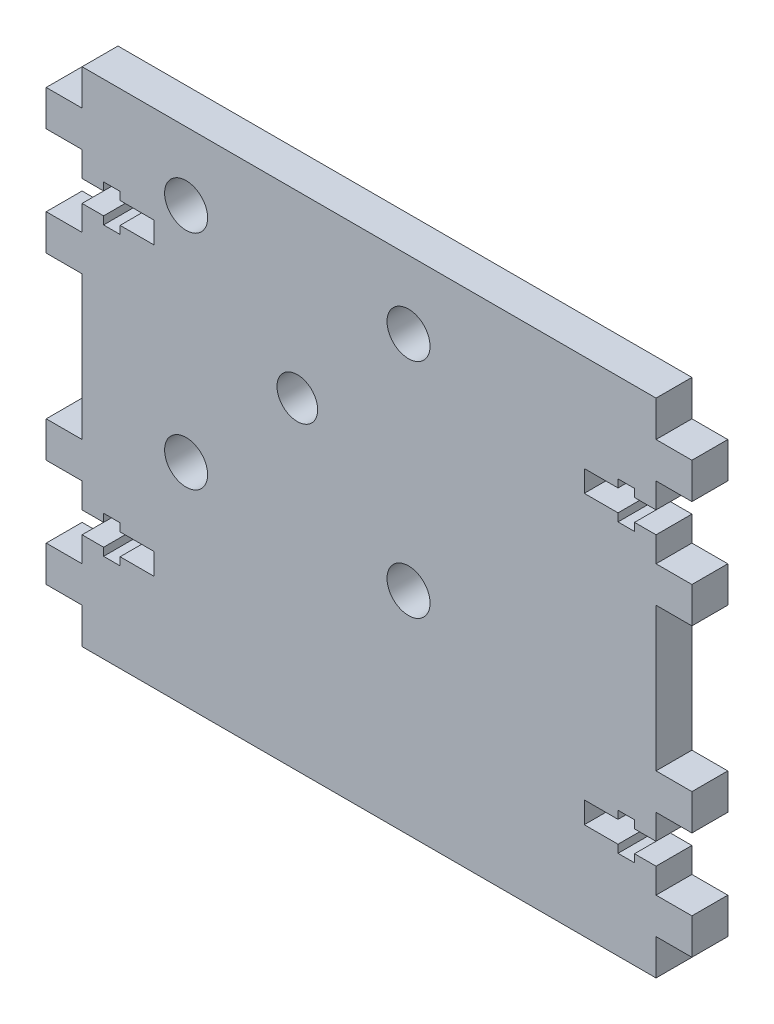
from build123d import *

# Parameters (mm, degrees)
SKETCH1_R           = 3
SKETCH1_R_2         = 2.835274302
BOSS_EXTRUDE1_DEPTH = 5


with BuildPart() as part:
    # Sketch1 → Boss-Extrude1 (new body)
    with BuildSketch(Plane.XY):
        Polygon((0, 70), (-80, 70), (-80, 65), (-85, 65), (-85, 60), (-80, 60), (-80, 56.5), (-77, 56.5), (-77, 57.6), (-74.7, 57.6), (-74.7, 56.5), (-70, 56.5), (-70, 53.5), (-74.7, 53.5), (-74.7, 52.4), (-77, 52.4), (-77, 53.5), (-80, 53.5), (-80, 50), (-85, 50), (-85, 45), (-80, 45), (-80, 25), (-85, 25), (-85, 20), (-80, 20), (-80, 16.5), (-77, 16.5), (-77, 17.6), (-74.7, 17.6), (-74.7, 16.5), (-70, 16.5), (-70, 13.5), (-74.7, 13.5), (-74.7, 12.4), (-77, 12.4), (-77, 13.5), (-80, 13.5), (-80, 10), (-85, 10), (-85, 5), (-80, 5), (-80, 0), (0, 0), (0, 5), (5, 5), (5, 10), (0, 10), (0, 13.5), (-3, 13.5), (-3, 12.4), (-5.3, 12.4), (-5.3, 13.5), (-10, 13.5), (-10, 16.5), (-5.3, 16.5), (-5.3, 17.6), (-3, 17.6), (-3, 16.5), (0, 16.5), (0, 20), (5, 20), (5, 25), (0, 25), (0, 45), (5, 45), (5, 50), (0, 50), (0, 53.5), (-3, 53.5), (-3, 52.4), (-5.3, 52.4), (-5.3, 53.5), (-10, 53.5), (-10, 56.5), (-5.3, 56.5), (-5.3, 57.6), (-3, 57.6), (-3, 56.5), (0, 56.5), (0, 60), (5, 60), (5, 65), (0, 65), align=None)
        with Locations((-65.5, 60.5)):
            Circle(SKETCH1_R, mode=Mode.SUBTRACT)
        with Locations((-34.5, 60.5)):
            Circle(SKETCH1_R, mode=Mode.SUBTRACT)
        with Locations((-65.5, 29.5)):
            Circle(SKETCH1_R, mode=Mode.SUBTRACT)
        with Locations((-34.5, 29.5)):
            Circle(SKETCH1_R, mode=Mode.SUBTRACT)
        with Locations((-50, 45)):
            Circle(SKETCH1_R_2, mode=Mode.SUBTRACT)
    extrude(amount=BOSS_EXTRUDE1_DEPTH)


solid = part.part
